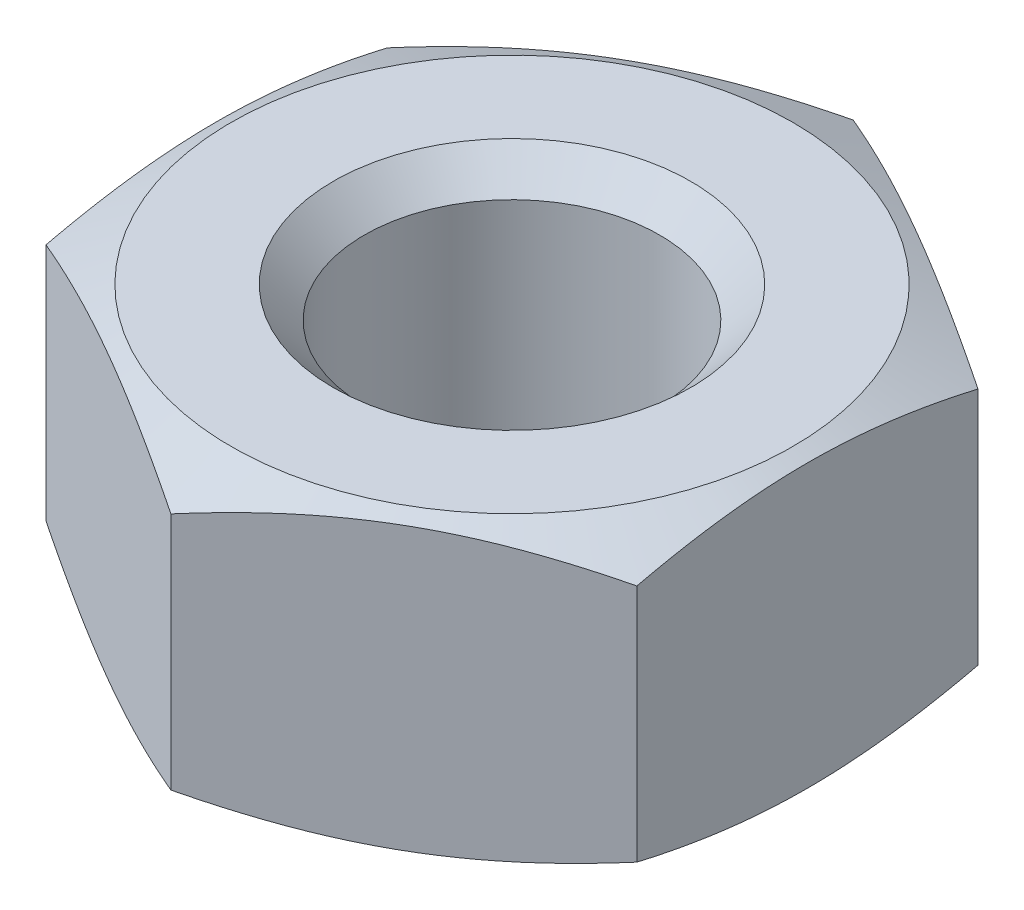
from build123d import *

# Parameters (mm, degrees)
BOSS_EXTRUDE1_DEPTH = 2.5


with BuildPart() as part:
    # Sketch1 → Boss-Extrude1 (new, symmetric)
    with BuildSketch(Plane(origin=(0, 0, 0), x_dir=(1, 0, 0), z_dir=(0, 1, 0))):
        Polygon((0, 5.773502692), (-5, 2.886751346), (-5, -2.886751346), (0, -5.773502692), (5, -2.886751346), (5, 2.886751346), align=None)
    extrude(amount=BOSS_EXTRUDE1_DEPTH, both=True)

    # Sketch2 → Cut-Revolve1 (revolve, cut)
    with BuildSketch(Plane.XY, mode=Mode.PRIVATE) as cut_revolve1_sk:
        Polygon((-4.75274654, 2.5), (-5.825, 2), (-5.825, 2.5), align=None)
    cut_revolve1 = revolve(cut_revolve1_sk.sketch.rotate(Axis((0, 0, 0), (0, 1, 0)), 270), axis=Axis((0, 0, 0), (0, 1, 0)), mode=Mode.SUBTRACT)

    # Mirror1: Cut-Revolve1 across plane
    add(cut_revolve1.mirror(Plane.ZX), mode=Mode.SUBTRACT)

    # Sketch4 → M6 Tapped Hole1 (revolve, cut)
    with BuildSketch(Plane(origin=(0, 2.5, 0), x_dir=(0, 0, 1), z_dir=(1, 0, 0))):
        Polygon((0, 0), (0, 5), (3.025, 5), (2.5, 4.475), (2.5, 0.525), (3.025, 0), align=None)
    revolve(axis=Axis((0, 8.85, 0), (0, -1, 0)), mode=Mode.SUBTRACT)


solid = part.part
